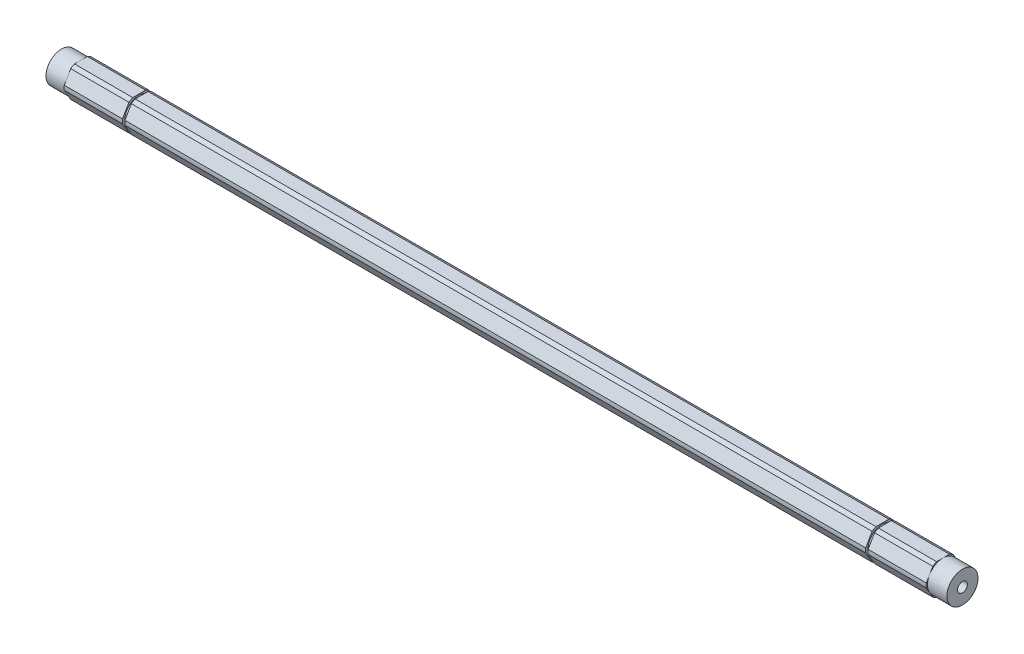
from build123d import *

# Parameters (mm, degrees)
SKETCH1_R               = 2.0193
BOSS_EXTRUDE1_DEPTH     = 184.15
SKETCH2_R               = 8.89
SKETCH2_R_2             = 6.35
CUT_EXTRUDE_THIN1_DEPTH = 7.9375
SKETCH4_W               = 0.9906
SKETCH4_H               = 2.802626001


with BuildPart() as part:
    # Sketch1 → Boss-Extrude1 (new, symmetric)
    with BuildSketch(Plane(origin=(0, 0, 0), x_dir=(0, 0, -1), z_dir=(1, 0, 0))):
        with BuildLine():
            ThreePointArc((6.874999966, 0), (6.860422465, 0.447468582), (6.816751782, 0.893039571))
            Line((6.816751782, 0.893039571), (4.181770846, 5.456960429))
            ThreePointArc((4.181770846, 5.456960429), (3.437499983, 5.953924622), (2.634980936, 6.35))
            Line((2.634980936, 6.35), (-2.634980936, 6.35))
            ThreePointArc((-2.634980936, 6.35), (-3.437499983, 5.953924622), (-4.181770846, 5.456960429))
            Line((-4.181770846, 5.456960429), (-6.816751782, 0.893039571))
            ThreePointArc((-6.816751782, 0.893039571), (-6.874999966, 0), (-6.816751782, -0.893039571))
            Line((-6.816751782, -0.893039571), (-4.181770846, -5.456960429))
            ThreePointArc((-4.181770846, -5.456960429), (-3.437499983, -5.953924622), (-2.634980936, -6.35))
            Line((-2.634980936, -6.35), (2.634980936, -6.35))
            ThreePointArc((2.634980936, -6.35), (3.437499983, -5.953924622), (4.181770846, -5.456960429))
            Line((4.181770846, -5.456960429), (6.816751782, -0.893039571))
            ThreePointArc((6.816751782, -0.893039571), (6.860422465, -0.447468582), (6.874999966, 0))
        make_face()
        Circle(SKETCH1_R, mode=Mode.SUBTRACT)
    extrude(amount=BOSS_EXTRUDE1_DEPTH, both=True)

    # Sketch2 → Cut-Extrude-Thin1 (cut)
    with BuildSketch(Plane(origin=(184.15, 0, 0), x_dir=(0, 0, -1), z_dir=(1, 0, 0))):
        Circle(SKETCH2_R)
        Circle(SKETCH2_R_2, mode=Mode.SUBTRACT)
    cut_extrude_thin1 = extrude(amount=-CUT_EXTRUDE_THIN1_DEPTH, mode=Mode.SUBTRACT)

    # Mirror1: Cut-Extrude-Thin1 across plane
    add(cut_extrude_thin1.mirror(Plane(origin=(0, 0, 0), x_dir=(0, 0, 1), z_dir=(1, 0, 0))), mode=Mode.SUBTRACT)

    # Sketch4 → Cut-Revolve7 (revolve, cut)
    with BuildSketch(Plane.XY, mode=Mode.PRIVATE) as cut_revolve7_sk:
        with Locations((151.9047, 7.256013001)):
            Rectangle(SKETCH4_W, SKETCH4_H)
    cut_revolve7 = revolve(cut_revolve7_sk.sketch.rotate(Axis((184.15, 0, 0), (-1, 0, 0)), 300), axis=Axis((184.15, 0, 0), (-1, 0, 0)), mode=Mode.SUBTRACT)

    # Mirror2: Cut-Revolve7 across plane
    add(cut_revolve7.mirror(Plane(origin=(0, 0, 0), x_dir=(0, 0, 1), z_dir=(1, 0, 0))), mode=Mode.SUBTRACT)


solid = part.part
